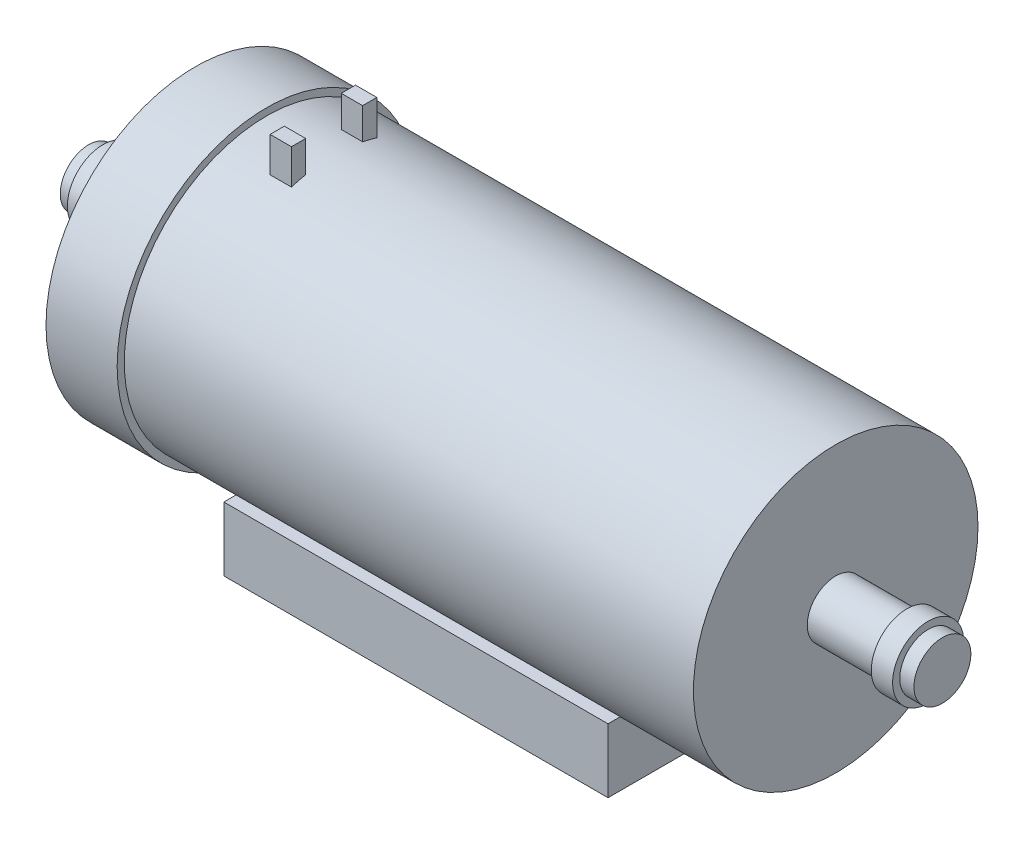
from build123d import *

# Parameters (mm, degrees)
PUMP_BODY_START     = -45
SKETCH1_R           = 20
PUMP_BODY_DEPTH     = 90
MOTOR_ENDBELL_START = -45
SKETCH2_R           = 21
MOTOR_ENDBELL_DEPTH = 10
SKETCH3_W           = 54
SKETCH3_H           = 28
MOUNT_SADDLE_DEPTH  = 9
INLET_BARB_START    = -60
SKETCH4_R           = 4
INLET_BARB_DEPTH    = 15
OUTLET_BARB_START   = 45
SKETCH5_R           = 4
OUTLET_BARB_DEPTH   = 15
INLET_RIDGE_START   = -58
SKETCH6_R           = 5
INLET_RIDGE_DEPTH   = 3
OUTLET_RIDGE_START  = 55
SKETCH7_R           = 5
OUTLET_RIDGE_DEPTH  = 3
TERMINAL_POS_START  = 43
SKETCH8_W           = 3
SKETCH8_H           = 2
TERMINAL_POS_DEPTH  = 6
TERMINAL_NEG_START  = 43
SKETCH9_W           = 3
SKETCH9_H           = 2
TERMINAL_NEG_DEPTH  = 6


with BuildPart() as part:
    # Sketch1 → Pump_Body (new body)
    with BuildSketch(Plane(origin=(0, 0, 0), x_dir=(0, 0, -1), z_dir=(1, 0, 0)).offset(PUMP_BODY_START)):
        with Locations(Location((0, 25, 0), (0, 0, 180))):
            Circle(SKETCH1_R)
    extrude(amount=PUMP_BODY_DEPTH)

    # Sketch2 → Motor_EndBell (add)
    with BuildSketch(Plane(origin=(0, 0, 0), x_dir=(0, 0, -1), z_dir=(1, 0, 0)).offset(MOTOR_ENDBELL_START)):
        with Locations((0, 25)):
            Circle(SKETCH2_R)
    extrude(amount=MOTOR_ENDBELL_DEPTH)

    # Sketch3 → Mount_Saddle (add)
    with BuildSketch(Plane(origin=(0, 0, 0), x_dir=(1, 0, 0), z_dir=(0, 1, 0))):
        Rectangle(SKETCH3_W, SKETCH3_H)
    extrude(amount=MOUNT_SADDLE_DEPTH)

    # Sketch4 → Inlet_Barb (add)
    with BuildSketch(Plane(origin=(0, 0, 0), x_dir=(0, 0, -1), z_dir=(1, 0, 0)).offset(INLET_BARB_START)):
        with Locations((0, 25)):
            Circle(SKETCH4_R)
    extrude(amount=INLET_BARB_DEPTH)

    # Sketch5 → Outlet_Barb (add)
    with BuildSketch(Plane(origin=(0, 0, 0), x_dir=(0, 0, -1), z_dir=(1, 0, 0)).offset(OUTLET_BARB_START)):
        with Locations((0, 25)):
            Circle(SKETCH5_R)
    extrude(amount=OUTLET_BARB_DEPTH)

    # Sketch6 → Inlet_Ridge (add)
    with BuildSketch(Plane(origin=(0, 0, 0), x_dir=(0, 0, -1), z_dir=(1, 0, 0)).offset(INLET_RIDGE_START)):
        with Locations((0, 25)):
            Circle(SKETCH6_R)
    extrude(amount=INLET_RIDGE_DEPTH)

    # Sketch7 → Outlet_Ridge (add)
    with BuildSketch(Plane(origin=(0, 0, 0), x_dir=(0, 0, -1), z_dir=(1, 0, 0)).offset(OUTLET_RIDGE_START)):
        with Locations((0, 25)):
            Circle(SKETCH7_R)
    extrude(amount=OUTLET_RIDGE_DEPTH)

    # Sketch8 → Terminal_Pos (add)
    with BuildSketch(Plane(origin=(0, 0, 0), x_dir=(1, 0, 0), z_dir=(0, 1, 0)).offset(TERMINAL_POS_START)):
        with Locations((-27, 5)):
            Rectangle(SKETCH8_W, SKETCH8_H)
    extrude(amount=TERMINAL_POS_DEPTH)

    # Sketch9 → Terminal_Neg (add)
    with BuildSketch(Plane(origin=(0, 0, 0), x_dir=(1, 0, 0), z_dir=(0, 1, 0)).offset(TERMINAL_NEG_START)):
        with Locations((-27, -5)):
            Rectangle(SKETCH9_W, SKETCH9_H)
    extrude(amount=TERMINAL_NEG_DEPTH)


solid = part.part
